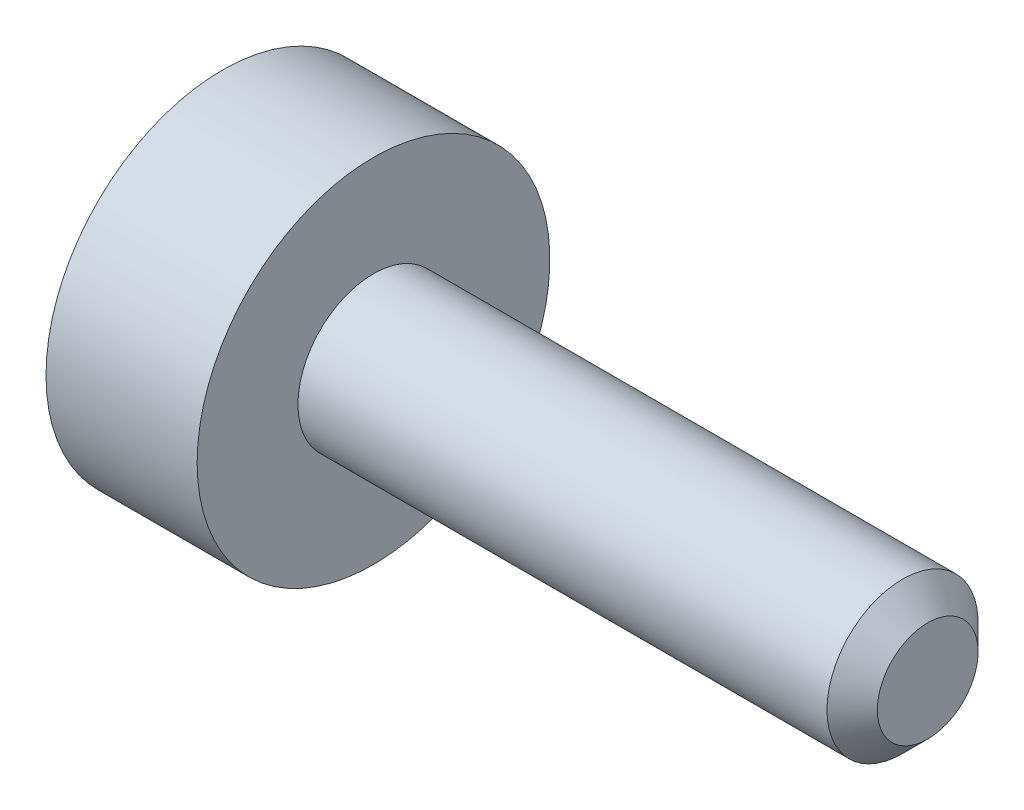
from build123d import *

# Parameters (mm, degrees)
CUT_EXTRUDE1_DEPTH = 1.5


with BuildPart() as part:
    # Sketch1 → Revolve1 (revolve)
    with BuildSketch(Plane.XY, mode=Mode.PRIVATE) as revolve1_sk:
        Polygon((0, 0), (0, 1), (-0.5, 1.5), (-11, 1.5), (-11, 3.5), (-14, 3.5), (-14, 0), align=None)
    revolve(revolve1_sk.sketch.rotate(Axis((0, 0, 0), (1, 0, 0)), 90), axis=Axis((0, 0, 0), (1, 0, 0)))

    # Sketch2 → Cut-Extrude1 (cut)
    with BuildSketch(Plane.ZY.offset(14)):
        Polygon((0, 1.732050808), (-1.5, 0.866025404), (-1.5, -0.866025404), (0, -1.732050808), (1.5, -0.866025404), (1.5, 0.866025404), align=None)
    extrude(amount=-CUT_EXTRUDE1_DEPTH, mode=Mode.SUBTRACT)


solid = part.part
